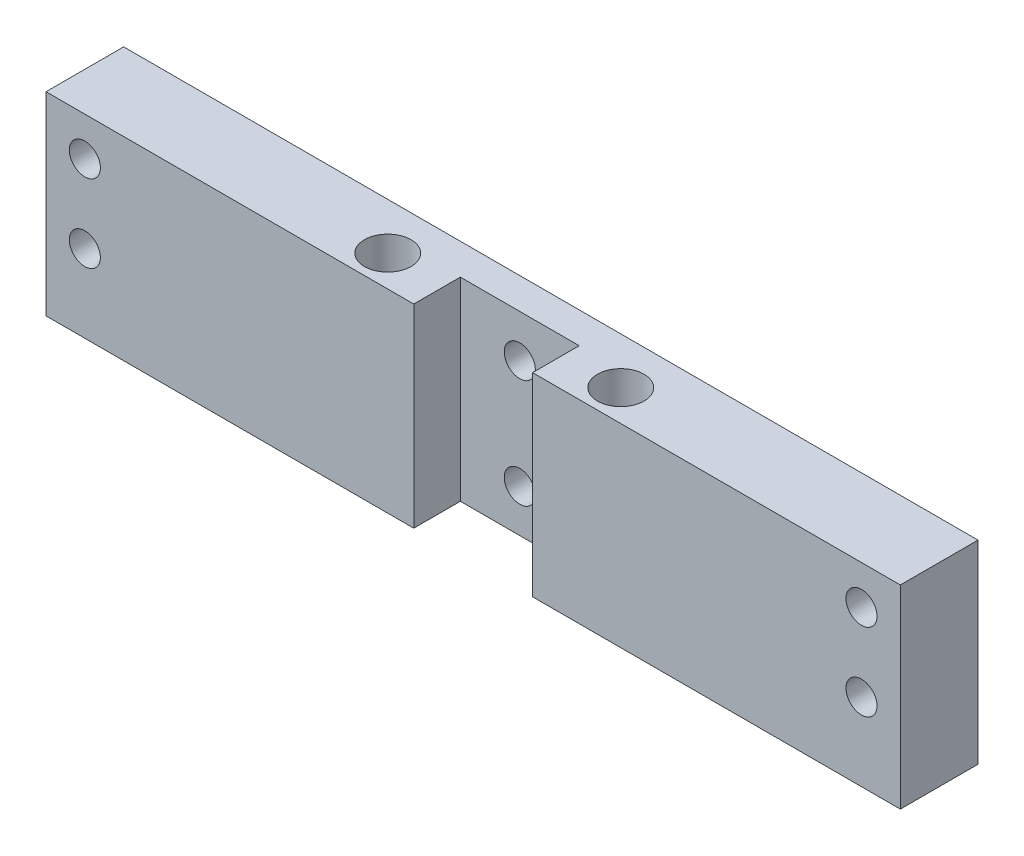
from build123d import *

# Parameters (mm, degrees)
ESQUISSE1_W             = 110
ESQUISSE1_H             = 25
ESQUISSE1_R             = 2
BOSS_EXTRU_1_DEPTH      = 10
ESQUISSE2_W             = 15.3
ESQUISSE2_H             = 25
ENL_V_MAT_EXTRU_1_DEPTH = 6
ESQUISSE3_R             = 3
ENL_V_MAT_EXTRU_2_DEPTH = 15


with BuildPart() as part:
    # Esquisse1 → Boss.-Extru.1 (new body)
    with BuildSketch(Plane.XY):
        with Locations((55, 12.5)):
            Rectangle(ESQUISSE1_W, ESQUISSE1_H)
        with Locations((5, 20)):
            Circle(ESQUISSE1_R, mode=Mode.SUBTRACT)
        with Locations((5, 10)):
            Circle(ESQUISSE1_R, mode=Mode.SUBTRACT)
        with Locations((105, 20)):
            Circle(ESQUISSE1_R, mode=Mode.SUBTRACT)
        with Locations((105, 10)):
            Circle(ESQUISSE1_R, mode=Mode.SUBTRACT)
        with Locations((55, 19.5)):
            Circle(ESQUISSE1_R, mode=Mode.SUBTRACT)
        with Locations((55, 5.5)):
            Circle(ESQUISSE1_R, mode=Mode.SUBTRACT)
    extrude(amount=BOSS_EXTRU_1_DEPTH)

    # Esquisse2 → Enlèv. mat.-Extru.1 (cut)
    with BuildSketch(Plane.XY.offset(10)):
        with Locations((55, 12.5)):
            Rectangle(ESQUISSE2_W, ESQUISSE2_H)
    extrude(amount=-ENL_V_MAT_EXTRU_1_DEPTH, mode=Mode.SUBTRACT)

    # Esquisse3 → Enlèv. mat.-Extru.2 (cut)
    with BuildSketch(Plane(origin=(0, 25, 0), x_dir=(1, 0, 0), z_dir=(0, 1, 0))):
        with Locations(Location((70, -6, 0), (0, 0, 180))):
            Circle(ESQUISSE3_R)
        with Locations(Location((40, -6, 0), (0, 0, 180))):
            Circle(ESQUISSE3_R)
    extrude(amount=-ENL_V_MAT_EXTRU_2_DEPTH, mode=Mode.SUBTRACT)


solid = part.part
